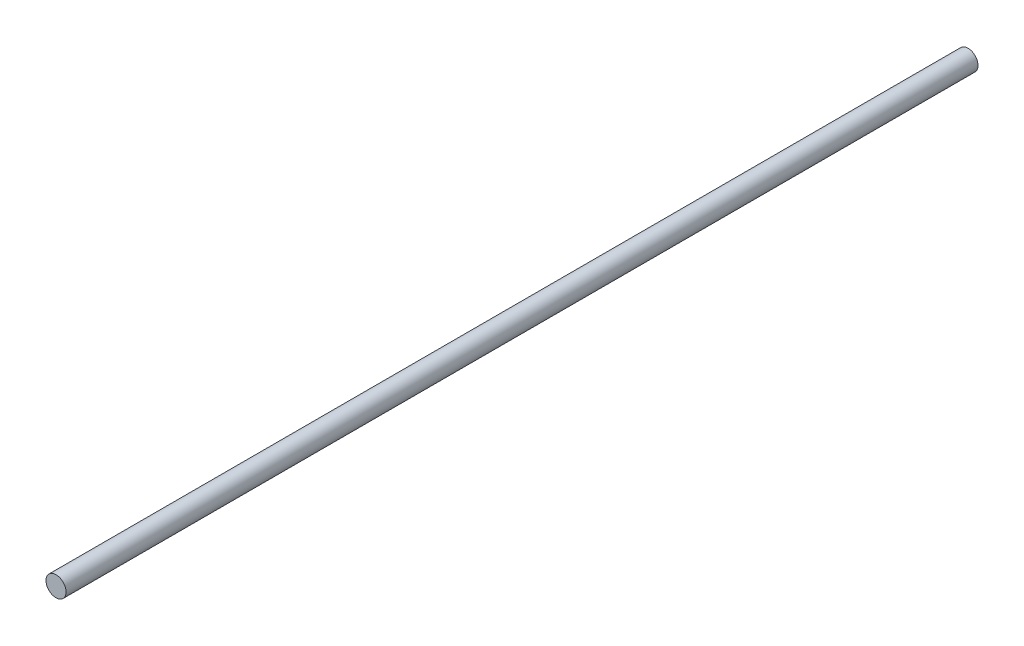
from build123d import *

# Parameters (mm, degrees)
SKETCH1_R           = 1.5875
BOSS_EXTRUDE1_DEPTH = 144.4625


with BuildPart() as part:
    # Sketch1 → Boss-Extrude1 (new body)
    with BuildSketch(Plane.XY):
        Circle(SKETCH1_R)
    extrude(amount=BOSS_EXTRUDE1_DEPTH)


solid = part.part
